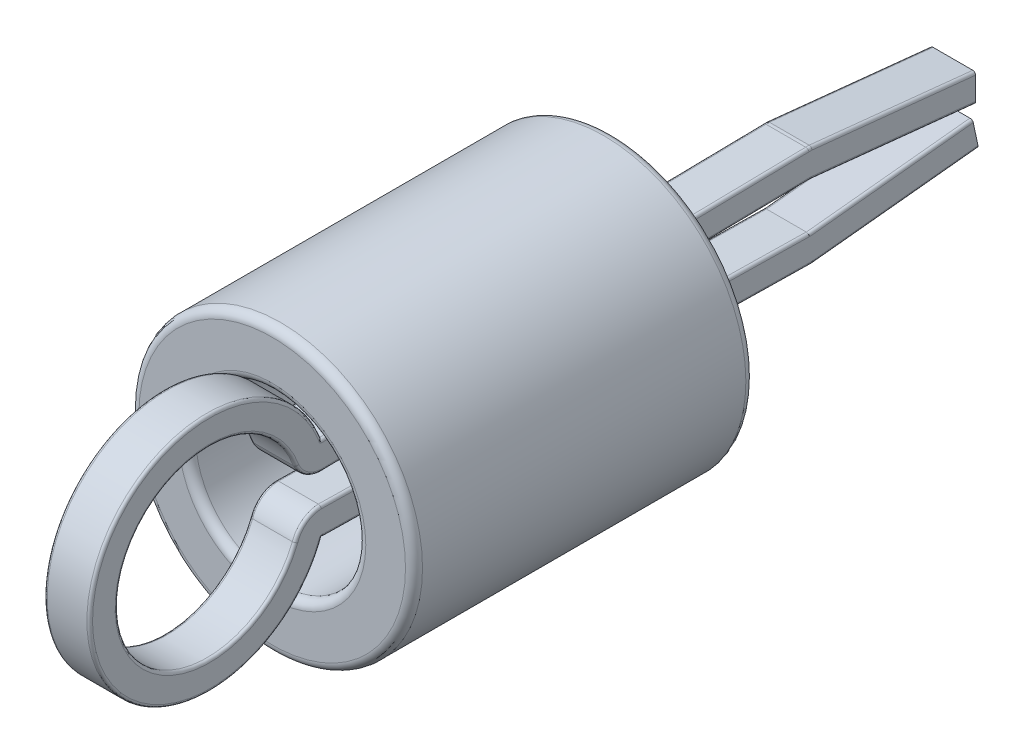
from build123d import *

# Parameters (mm, degrees)
SKETCH1_R          = 1.27
SKETCH1_R_2        = 0.762
PLASTIC_RING_DEPTH = 3.048
FILLET1_R          = 0.0762


with BuildPart() as part:
    # Sketch1 → Plastic-Ring (new body)
    with BuildSketch(Plane.XY):
        with Locations(Location((0, 0, 0), (0, 0, 180))):
            Circle(SKETCH1_R)
        with Locations(Location((0, 0, 0), (0, 0, 180))):
            Circle(SKETCH1_R_2, mode=Mode.SUBTRACT)
    extrude(amount=PLASTIC_RING_DEPTH)

    # Fillet1
    fillet1_edges = [part.edges().sort_by_distance(p)[0] for p in [
        (1.27, 0, 0),
        (1.27, 0, 3.048),
        (0.762, 0, 0),
        (0.762, 0, 3.048),
    ]]
    fillet(fillet1_edges, radius=FILLET1_R)


with BuildPart() as body_2:
    # Sweep3: sweep along a path in wire-bend
    with BuildLine(Plane(origin=(0, 0, 0), x_dir=(0, 0, -1), z_dir=(1, 0, 0))) as sweep3_path:
        Line((3.048, 0.1778), (1.58239661, 0.329414144))
        ThreePointArc((1.58239661, 0.329414144), (1.574790134, 0.329970789), (1.56716396, 0.33006984))
        Line((1.56716396, 0.33006984), (-2.802121642, 0.255593381))
        ThreePointArc((-2.802121642, 0.255593381), (-2.875484113, 0.277409147), (-2.922987788, 0.337420652))
        ThreePointArc((-2.922987788, 0.337420652), (-4.759022318, 0), (-2.922987788, -0.337420652))
        ThreePointArc((-2.922987788, -0.337420652), (-2.875484113, -0.277409147), (-2.802121642, -0.255593381))
        Line((-2.802121642, -0.255593381), (1.56716396, -0.33006984))
        ThreePointArc((1.56716396, -0.33006984), (1.574790134, -0.329970789), (1.58239661, -0.329414144))
        Line((1.58239661, -0.329414144), (3.048, -0.1778))
    # wire-profile → Sweep3 (sweep)
    with BuildSketch(Plane.XY.offset(-3.048)):
        with BuildLine():
            Line((-0.1778, 0.3048), (0.1778, 0.3048))
            ThreePointArc((0.1778, 0.3048), (0.195760512, 0.297360512), (0.2032, 0.2794))
            Line((0.2032, 0.2794), (0.2032, 0.0762))
            ThreePointArc((0.2032, 0.0762), (0.195760512, 0.058239488), (0.1778, 0.0508))
            Line((0.1778, 0.0508), (-0.1778, 0.0508))
            ThreePointArc((-0.1778, 0.0508), (-0.195760512, 0.058239488), (-0.2032, 0.0762))
            Line((-0.2032, 0.0762), (-0.2032, 0.2794))
            ThreePointArc((-0.2032, 0.2794), (-0.195760512, 0.297360512), (-0.1778, 0.3048))
        make_face()
    sweep(path=sweep3_path.line)


solid = Compound([part.part, body_2.part])
